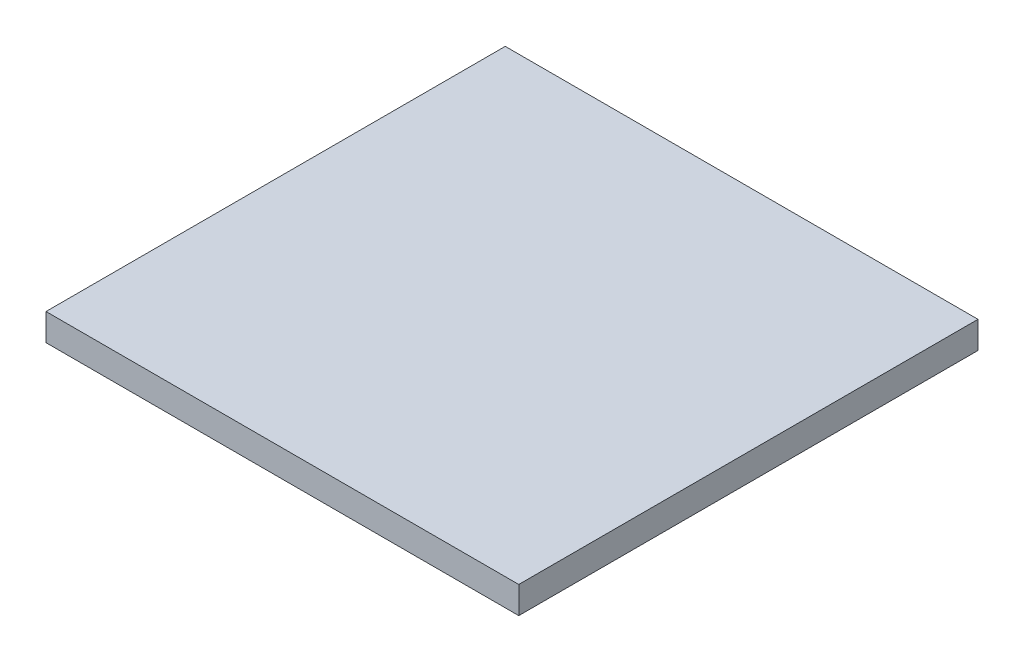
from build123d import *

# Parameters (mm, degrees)
SKETCH1_W     = 70
SKETCH1_H     = 4
PROFILE_DEPTH = 68


with BuildPart() as part:
    # Sketch1 → Profile (new body)
    with BuildSketch(Plane.XY):
        with Locations((35, 2)):
            Rectangle(SKETCH1_W, SKETCH1_H)
    extrude(amount=PROFILE_DEPTH)


solid = part.part
